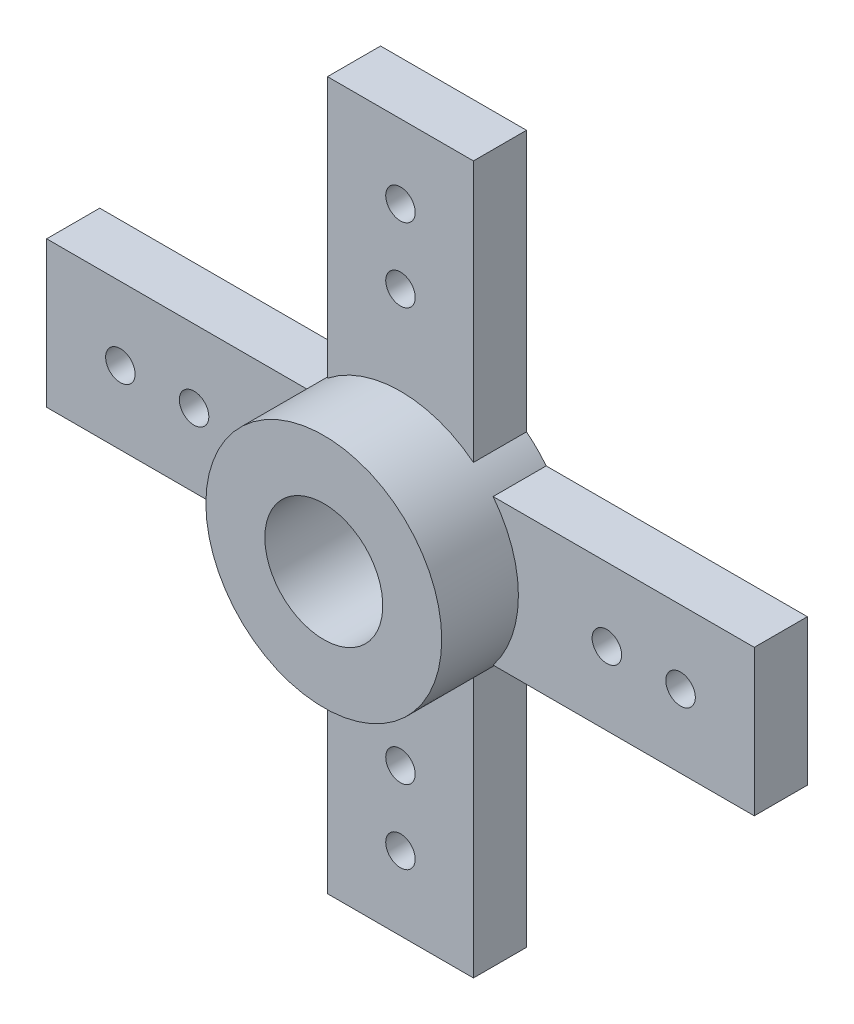
from build123d import *

# Parameters (mm, degrees)
SKETCH1_R                       = 0.5
BOSS_EXTRUDE1_DEPTH             = 1.8
SKETCH2_R                       = 4
BOSS_EXTRUDE2_DEPTH             = 2.6
BOSS_EXTRUDE2_DIRECTION_2_REACH = 19.066
SKETCH3_R                       = 2
CUT_EXTRUDE1_DEPTH              = 18.531685601


with BuildPart() as part:
    # Sketch1 → Boss-Extrude1 (new body)
    with BuildSketch(Plane.XY):
        Polygon((-2.475, -12), (2.475, -12), (2.475, -2.475), (12, -2.475), (12, 2.475), (2.475, 2.475), (2.475, 12), (-2.475, 12), (-2.475, 2.475), (-12, 2.475), (-12, -2.475), (-2.475, -2.475), align=None)
        with Locations((0, 9.5)):
            Circle(SKETCH1_R, mode=Mode.SUBTRACT)
        with Locations((0, 7)):
            Circle(SKETCH1_R, mode=Mode.SUBTRACT)
        with Locations(Location((0, -9.5, 0), (0, 0, 180))):
            Circle(SKETCH1_R, mode=Mode.SUBTRACT)
        with Locations(Location((0, -7, 0), (0, 0, 180))):
            Circle(SKETCH1_R, mode=Mode.SUBTRACT)
        with Locations((-9.5, 0)):
            Circle(SKETCH1_R, mode=Mode.SUBTRACT)
        with Locations((-7, 0)):
            Circle(SKETCH1_R, mode=Mode.SUBTRACT)
        with Locations(Location((9.5, 0, 0), (0, 0, 180))):
            Circle(SKETCH1_R, mode=Mode.SUBTRACT)
        with Locations(Location((7, 0, 0), (0, 0, 180))):
            Circle(SKETCH1_R, mode=Mode.SUBTRACT)
    extrude(amount=BOSS_EXTRUDE1_DEPTH)

    # Sketch2 → Boss-Extrude2 (add)
    with BuildSketch(Plane.XY.offset(1.8)):
        Circle(SKETCH2_R)
    extrude(amount=BOSS_EXTRUDE2_DEPTH)

    # Boss-Extrude2 direction 2: up to this face of the body (flat: up to its plane)
    boss_extrude2_direction_2_end = Plane(part.part.faces().sort_by_distance((0, 0, 0))[0])
    # Sketch2 → Boss-Extrude2 direction 2 (add, up to the picked face)
    with BuildSketch(Plane.XY.offset(1.8), mode=Mode.PRIVATE) as boss_extrude2_direction_2_sk1:
        Circle(SKETCH2_R)
    boss_extrude2_direction_2_tool1 = split(extrude(boss_extrude2_direction_2_sk1.sketch, amount=-BOSS_EXTRUDE2_DIRECTION_2_REACH, mode=Mode.PRIVATE), bisect_by=boss_extrude2_direction_2_end, keep=Keep.BOTH, mode=Mode.PRIVATE)
    add(boss_extrude2_direction_2_tool1.solids().sort_by(Axis((0, 0, 1.8), (0, 0, -1)))[0])

    # Sketch3 → Cut-Extrude1 (cut, through all)
    with BuildSketch(Plane(origin=(0, 0, 0), x_dir=(-1, 0, 0), z_dir=(0, 0, -1))):
        Circle(SKETCH3_R)
    extrude(amount=-CUT_EXTRUDE1_DEPTH, mode=Mode.SUBTRACT)


solid = part.part
